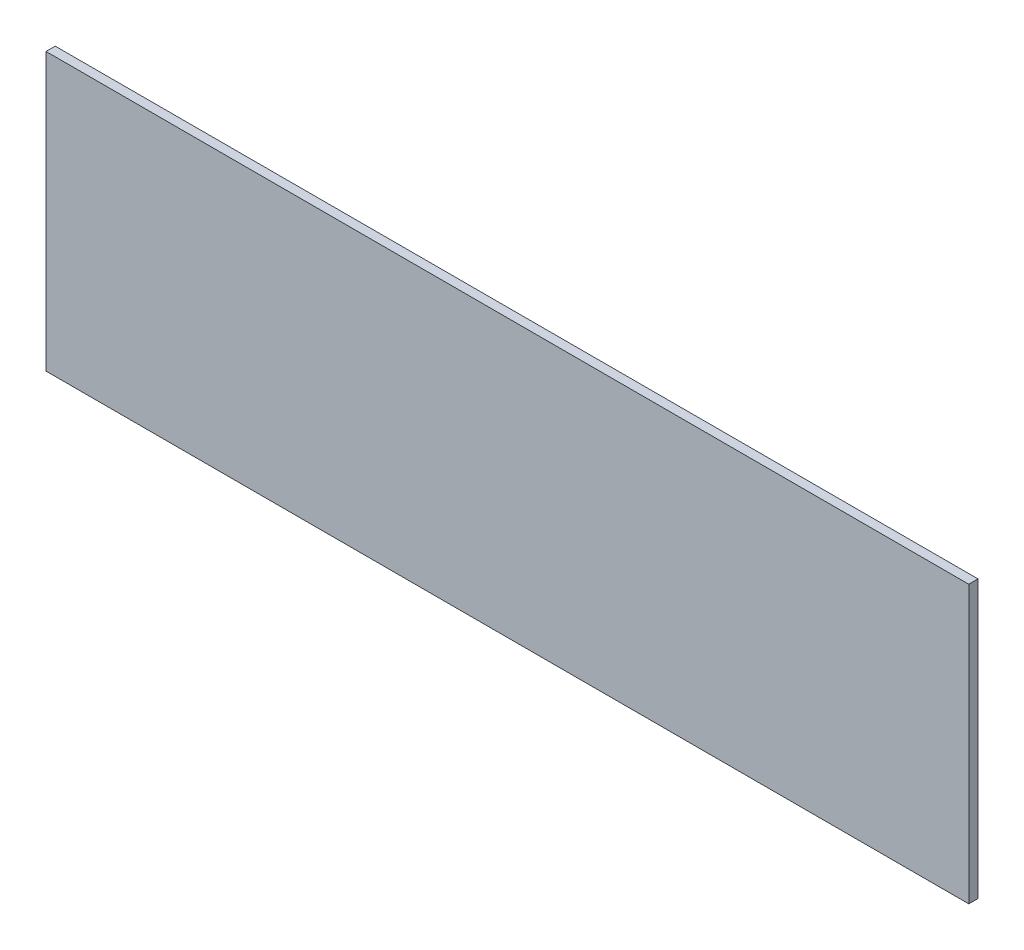
from build123d import *

# Parameters (mm, degrees)
SKETCH1_W           = 500
SKETCH1_H           = 150
BOSS_EXTRUDE1_DEPTH = 5


with BuildPart() as part:
    # Sketch1 → Boss-Extrude1 (new body)
    with BuildSketch(Plane.XY):
        with Locations((250, -75)):
            Rectangle(SKETCH1_W, SKETCH1_H)
    extrude(amount=BOSS_EXTRUDE1_DEPTH)


solid = part.part
